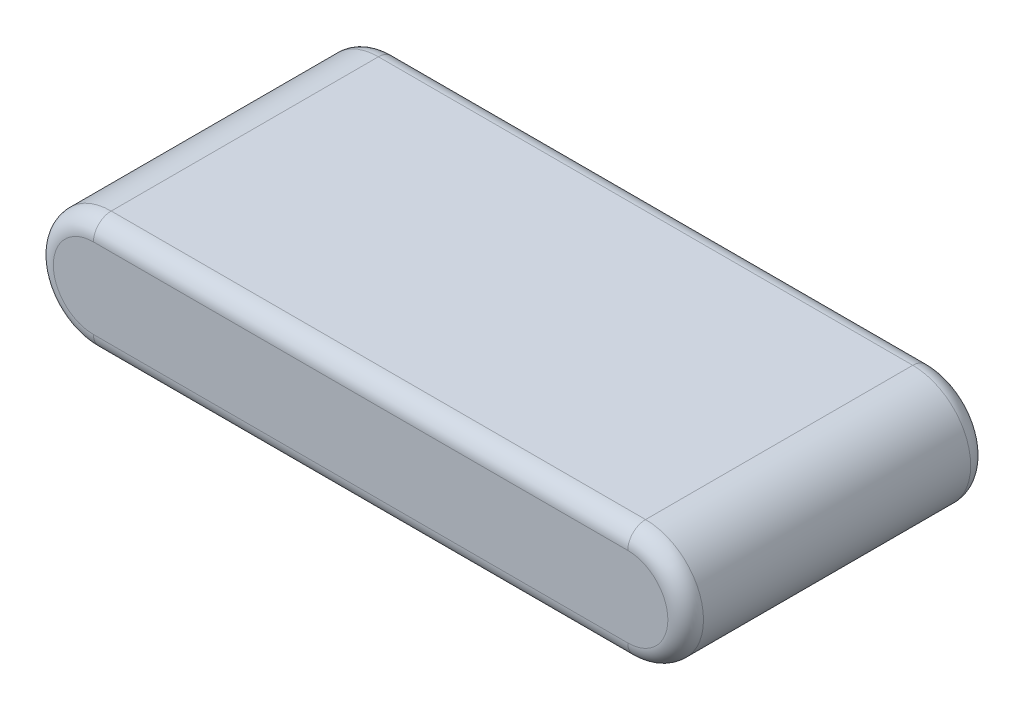
from build123d import *

# Parameters (mm, degrees)
RESSALTO_EXTRUS_O1_DEPTH = 17
FILETE1_R                = 1


with BuildPart() as part:
    # Esboço1 → Ressalto-extrusão1 (new body)
    with BuildSketch(Plane.XY):
        with BuildLine():
            Line((0, 3.25), (30, 3.25))
            ThreePointArc((30, 3.25), (33.25, 0), (30, -3.25))
            Line((30, -3.25), (0, -3.25))
            ThreePointArc((0, -3.25), (-3.25, 0), (0, 3.25))
        make_face()
    extrude(amount=RESSALTO_EXTRUS_O1_DEPTH)

    # Filete1
    filete1_edges = [part.edges().sort_by_distance(p)[0] for p in [
        (33.25, 0, 17),
        (15, 3.25, 17),
        (-3.25, 0, 17),
        (15, 3.25, 0),
        (33.25, 0, 0),
        (15, -3.25, 0),
        (-3.25, 0, 0),
        (15, -3.25, 17),
    ]]
    fillet(filete1_edges, radius=FILETE1_R)


solid = part.part
